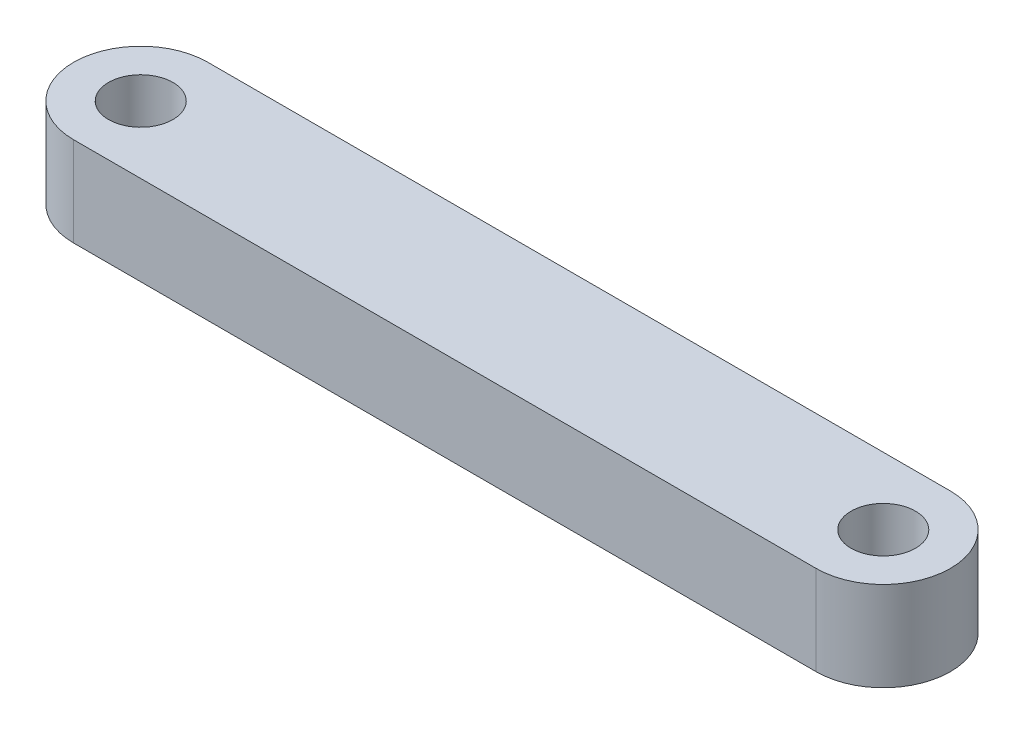
from build123d import *

# Parameters (mm, degrees)
SKETCH1_R           = 2.286
BOSS_EXTRUDE1_DEPTH = 6.35


with BuildPart() as part:
    # Sketch1 → Boss-Extrude1 (new body)
    with BuildSketch(Plane(origin=(0, 0, 0), x_dir=(1, 0, 0), z_dir=(0, 1, 0))):
        with BuildLine():
            Line((0, -4.7625), (-52.705, -4.7625))
            ThreePointArc((-52.705, -4.7625), (-57.4675, 0), (-52.705, 4.7625))
            Line((-52.705, 4.7625), (0, 4.7625))
            ThreePointArc((0, 4.7625), (4.7625, 0), (0, -4.7625))
        make_face()
        with Locations(Location((0, 0, 0), (0, 0, 270))):
            Circle(SKETCH1_R, mode=Mode.SUBTRACT)
        with Locations(Location((-52.705, 0, 0), (0, 0, 270))):
            Circle(SKETCH1_R, mode=Mode.SUBTRACT)
    extrude(amount=BOSS_EXTRUDE1_DEPTH)


solid = part.part
